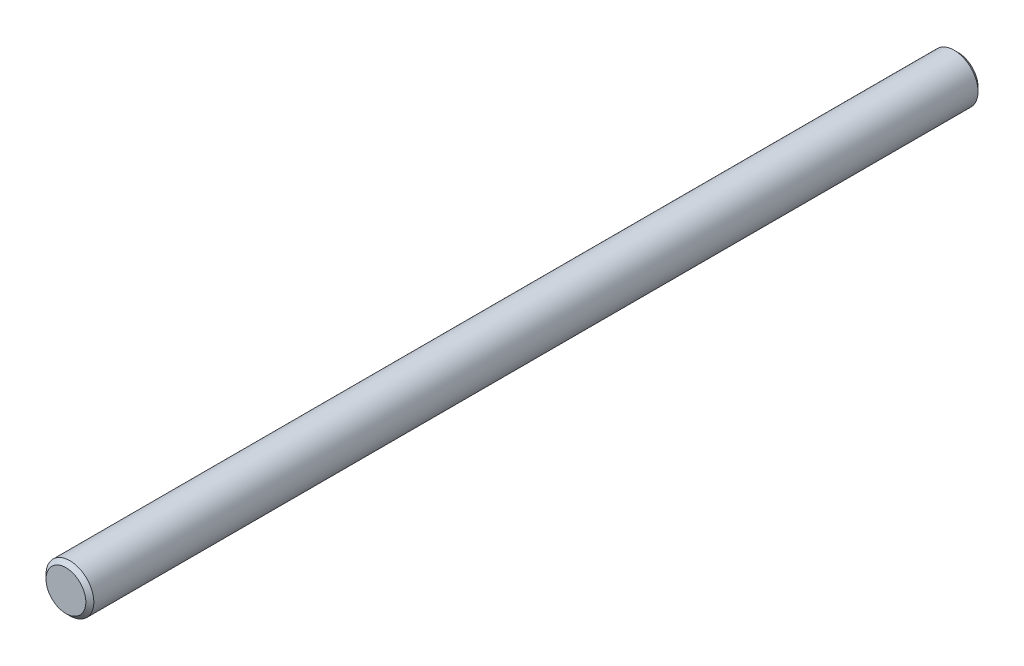
from build123d import *


with BuildPart() as part:
    # Esquisse1 → Révolution1 (revolve)
    with BuildSketch(Plane.XZ, mode=Mode.PRIVATE) as r_volution1_sk:
        Polygon((1.25, 28), (0, 28), (0, -28), (1.25, -28), (1.5, -27.75), (1.5, 27.75), align=None)
    revolve(r_volution1_sk.sketch.rotate(Axis((0, 0, 28), (0, 0, -1)), 180), axis=Axis((0, 0, 28), (0, 0, -1)))


solid = part.part
